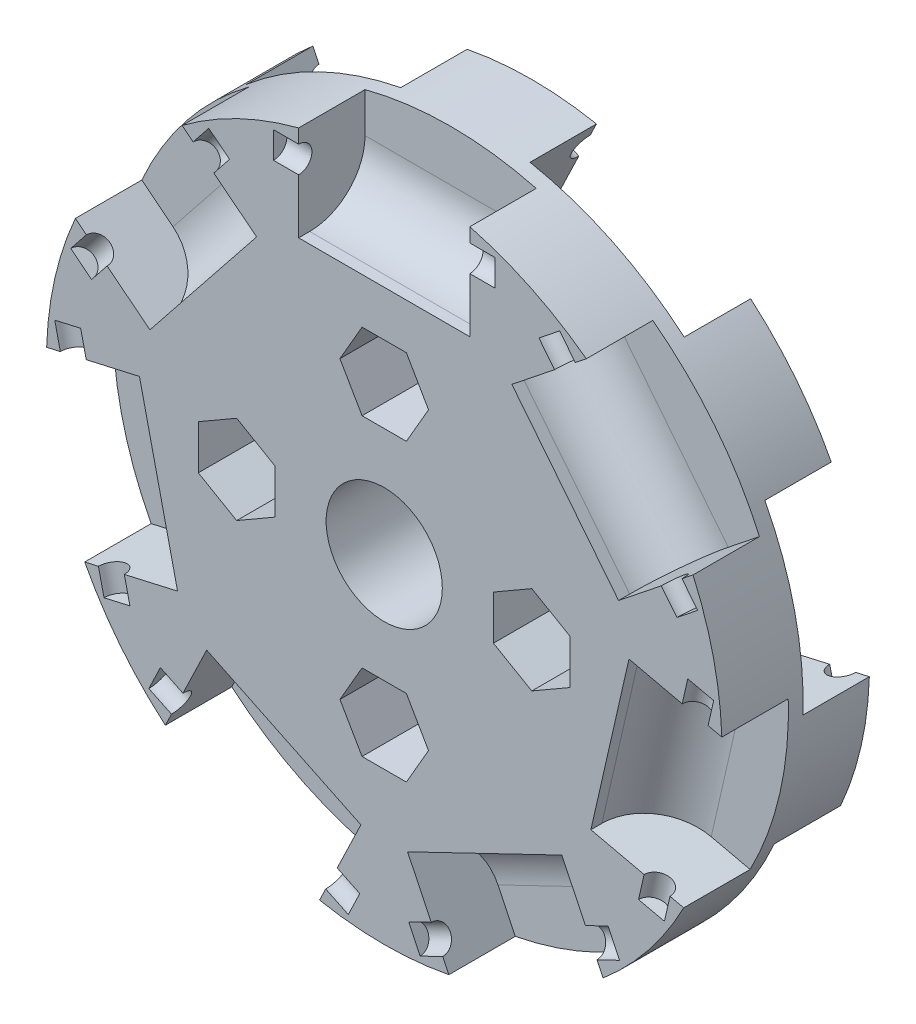
from build123d import *

# Parameters (mm, degrees)
SKETCH1_R           = 29.0703
BOSS_EXTRUDE2_DEPTH = 6.35
SKETCH2_W           = 14.732
SKETCH2_H           = 10.414
CUT_EXTRUDE2_DEPTH  = 5.715
CIRPATTERN1_COUNT   = 7
SKETCH4_R           = 1.143
CUT_EXTRUDE4_DEPTH  = 9.525
CIRPATTERN2_COUNT   = 7
CUT_EXTRUDE7_DEPTH  = 42.599124801
SKETCH9_R           = 29.0703
BOSS_EXTRUDE3_DEPTH = 6.35
CUT_EXTRUDE8_DEPTH  = 5.715
CIRPATTERN3_COUNT   = 7
SKETCH11_R          = 1.143
CUT_EXTRUDE9_DEPTH  = 9.525
CIRPATTERN4_COUNT   = 7
FILLET1_R           = 4.7625
SKETCH12_R          = 5
CUT_EXTRUDE12_DEPTH = 13.716


with BuildPart() as part:
    # Sketch1 → Boss-Extrude2 (new body)
    with BuildSketch(Plane.XY):
        Circle(SKETCH1_R)
    extrude(amount=-BOSS_EXTRUDE2_DEPTH)

    # Sketch2 → Cut-Extrude2 (cut)
    with BuildSketch(Plane.XY):
        with Locations((0, 25.1333)):
            Rectangle(SKETCH2_W, SKETCH2_H)
    cut_extrude2 = extrude(amount=-CUT_EXTRUDE2_DEPTH, mode=Mode.SUBTRACT)

    # CirPattern1: Cut-Extrude2 ×7 about axis
    cirpattern1_axis = Axis((0, 0, 0), (0, 0, 1))
    for i in range(1, CIRPATTERN1_COUNT):
        add(cut_extrude2.rotate(cirpattern1_axis, i * 360 / CIRPATTERN1_COUNT), mode=Mode.SUBTRACT)

    # Sketch4 → Cut-Extrude4 (cut, symmetric)
    with BuildSketch(Plane(origin=(0, 0, 0), x_dir=(0, 0, -1), z_dir=(1, 0, 0))):
        with Locations((0, 25.7683)):
            Circle(SKETCH4_R)
    cut_extrude4 = extrude(amount=CUT_EXTRUDE4_DEPTH, both=True, mode=Mode.SUBTRACT)

    # CirPattern2: Cut-Extrude4 ×7 about axis
    cirpattern2_axis = Axis((0, 0, 0), (0, 0, 1))
    for i in range(1, CIRPATTERN2_COUNT):
        add(cut_extrude4.rotate(cirpattern2_axis, i * 360 / CIRPATTERN2_COUNT), mode=Mode.SUBTRACT)

    # Sketch6 → Cut-Extrude7 (cut, through all)
    with BuildSketch(Plane(origin=(0, 0, -6.35), x_dir=(-1, 0, 0), z_dir=(0, 0, -1))):
        Polygon((12.7, -3.812821178), (16.002, -1.906410589), (16.002, 1.906410589), (12.7, 3.812821178), (9.398, 1.906410589), (9.398, -1.906410589), align=None)
        Polygon((3.812821178, 12.7), (1.906410589, 16.002), (-1.906410589, 16.002), (-3.812821178, 12.7), (-1.906410589, 9.398), (1.906410589, 9.398), align=None)
        Polygon((-3.812821178, -12.7), (-1.906410589, -16.002), (1.906410589, -16.002), (3.812821178, -12.7), (1.906410589, -9.398), (-1.906410589, -9.398), align=None)
        Polygon((-12.7, 3.812821178), (-16.002, 1.906410589), (-16.002, -1.906410589), (-12.7, -3.812821178), (-9.398, -1.906410589), (-9.398, 1.906410589), align=None)
    extrude(amount=-CUT_EXTRUDE7_DEPTH, mode=Mode.SUBTRACT)

    # Sketch9 → Boss-Extrude3 (add)
    with BuildSketch(Plane(origin=(0, 0, -6.35), x_dir=(-1, 0, 0), z_dir=(0, 0, -1))):
        with Locations(Location((0, 0, 0), (0, 0, 178.179188094))):
            Circle(SKETCH9_R)
        Polygon((12.7, -3.812821178), (16.002, -1.906410589), (16.002, 1.906410589), (12.7, 3.812821178), (9.398, 1.906410589), (9.398, -1.906410589), align=None, mode=Mode.SUBTRACT)
        Polygon((3.812821178, 12.7), (1.906410589, 16.002), (-1.906410589, 16.002), (-3.812821178, 12.7), (-1.906410589, 9.398), (1.906410589, 9.398), align=None, mode=Mode.SUBTRACT)
        Polygon((-3.812821178, -12.7), (-1.906410589, -16.002), (1.906410589, -16.002), (3.812821178, -12.7), (1.906410589, -9.398), (-1.906410589, -9.398), align=None, mode=Mode.SUBTRACT)
        Polygon((-12.7, 3.812821178), (-16.002, 1.906410589), (-16.002, -1.906410589), (-12.7, -3.812821178), (-9.398, -1.906410589), (-9.398, 1.906410589), align=None, mode=Mode.SUBTRACT)
    extrude(amount=BOSS_EXTRUDE3_DEPTH)

    # Sketch10 → Cut-Extrude8 (cut)
    with BuildSketch(Plane(origin=(0, 0, -12.7), x_dir=(-1, 0, 0), z_dir=(0, 0, -1))):
        Polygon((-2.009055407, 21.148973594), (-15.282160644, 14.757064537), (-19.800579114, 24.139776859), (-6.527473878, 30.531685916), align=None)
    cut_extrude8 = extrude(amount=-CUT_EXTRUDE8_DEPTH, mode=Mode.SUBTRACT)

    # CirPattern3: Cut-Extrude8 ×7 about axis
    cirpattern3_axis = Axis((0, 0, 0), (0, 0, 1))
    for i in range(1, CIRPATTERN3_COUNT):
        add(cut_extrude8.rotate(cirpattern3_axis, i * 360 / CIRPATTERN3_COUNT), mode=Mode.SUBTRACT)

    # Sketch11 → Cut-Extrude9 (cut, symmetric)
    with BuildSketch(Plane(origin=(0, 0, 0), x_dir=(0, 0, -1), z_dir=(-0.900971031519736, 0.4338792462912495, 0))):
        with Locations((12.7, -25.7683)):
            Circle(SKETCH11_R)
    cut_extrude9 = extrude(amount=CUT_EXTRUDE9_DEPTH, both=True, mode=Mode.SUBTRACT)

    # CirPattern4: Cut-Extrude9 ×7 about axis
    cirpattern4_axis = Axis((0, 0, 0), (0, 0, 1))
    for i in range(1, CIRPATTERN4_COUNT):
        add(cut_extrude9.rotate(cirpattern4_axis, i * 360 / CIRPATTERN4_COUNT), mode=Mode.SUBTRACT)

    # Fillet1
    fillet1_edges = [part.edges().sort_by_distance(p)[0] for p in [
        (-15.579008669, 12.423844839, -5.715),
        (0, 19.9263, -5.715),
        (8.645608025, 17.953019065, -6.985),
        (-8.645787076, 17.952932839, -6.985),
        (-19.426728167, 4.433922012, -6.985),
        (-15.578946715, -12.423922526, -6.985),
        (9.9366e-05, -19.9263, -6.985),
        (8.645697551, -17.952975952, -5.715),
        (15.579070622, -12.423767151, -6.985),
        (19.426683945, 4.434115761, -6.985),
        (19.426706057, -4.434018886, -5.715),
        (-19.426706057, -4.434018886, -5.715),
        (-8.645697551, -17.952975952, -5.715),
        (15.579008669, 12.423844839, -5.715),
    ]]
    fillet(fillet1_edges, radius=FILLET1_R)

    # Sketch12 → Cut-Extrude12 (cut)
    with BuildSketch(Plane.XY):
        Circle(SKETCH12_R)
    extrude(amount=-CUT_EXTRUDE12_DEPTH, mode=Mode.SUBTRACT)


solid = part.part
